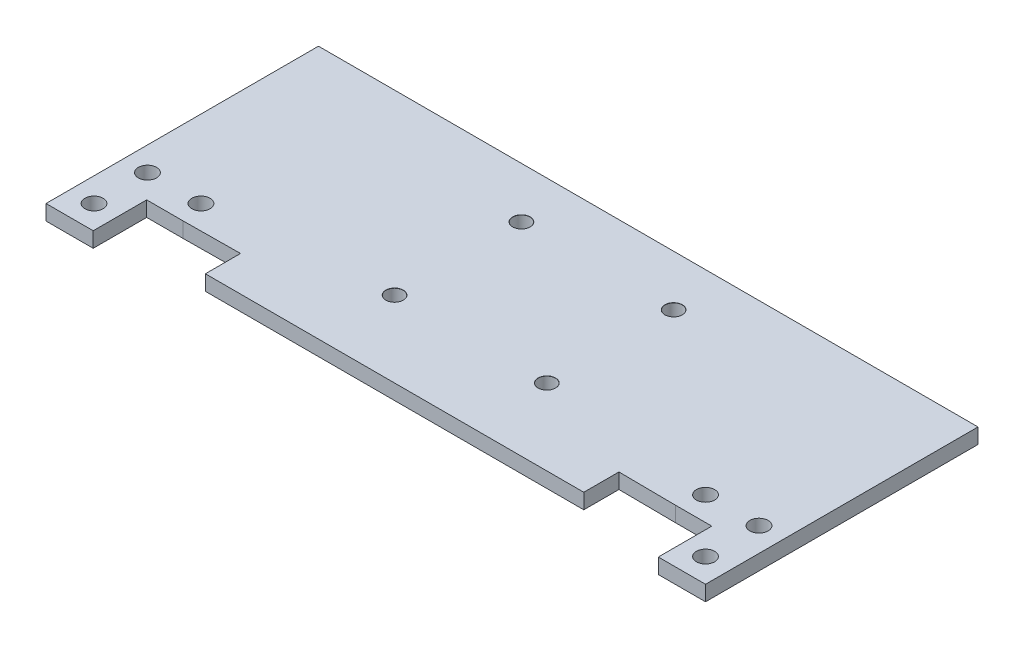
from build123d import *

# Parameters (mm, degrees)
SKETCH1_W                      = 50
SKETCH1_H                      = 3
BOSS_EXTRUDE1_DEPTH            = 130
M3_CLEARANCE_HOLE2_D           = 3.4
M3_CLEARANCE_HOLE2_CSINK_D     = 3.45
M3_CLEARANCE_HOLE2_CSINK_ANGLE = 90
SKETCH7_W                      = 9.304410209
SKETCH7_H                      = 3.710121499
BOSS_EXTRUDE2_DEPTH            = 3
CUT_EXTRUDE1_DEPTH             = 140.316187143
M3_CLEARANCE_HOLE3_D           = 3.6


with BuildPart() as part:
    # Sketch1 → Boss-Extrude1 (new body)
    with BuildSketch(Plane(origin=(0, 0, 0), x_dir=(0, 0, -1), z_dir=(1, 0, 0))):
        with Locations((25, 1.5)):
            Rectangle(SKETCH1_W, SKETCH1_H)
    extrude(amount=BOSS_EXTRUDE1_DEPTH)

    # M3 Clearance Hole2 (through all)
    with Locations(Plane(origin=(0, 3, 0), x_dir=(1, 0, 0), z_dir=(0, 1, 0))):
        with Locations((80, 15), (50, 40), (80, 40), (50, 15)):
            CounterSinkHole(M3_CLEARANCE_HOLE2_D / 2, M3_CLEARANCE_HOLE2_CSINK_D / 2, counter_sink_angle=M3_CLEARANCE_HOLE2_CSINK_ANGLE)

    # Sketch7 → Boss-Extrude2 (add)
    with BuildSketch(Plane.XZ):
        with Locations((125.347794896, 1.85506075)):
            Rectangle(SKETCH7_W, SKETCH7_H)
        with Locations((4.652205105, 1.85506075)):
            Rectangle(SKETCH7_W, SKETCH7_H)
    extrude(amount=-BOSS_EXTRUDE2_DEPTH)

    # Sketch9 → Cut-Extrude1 (cut, through all)
    with BuildSketch(Plane(origin=(0, 3, 0), x_dir=(1, 0, 0), z_dir=(0, 1, 0))):
        Polygon((120.495589791, 0), (120.495589791, 6.62967858), (113.495589791, 6.62967858), (102.495589791, 6.727622706), (102.495589791, 0), align=None)
        Polygon((120.495589791, -8.059319951), (120.495589791, 0), (102.495589791, 0), (102.495589791, -2.720319112), align=None)
        Polygon((120.695589791, 0), (120.495589791, 0), (120.495589791, -8.059319951), (102.495589791, -2.720319112), (102.495589791, 0), (102.295589791, 0), (102.295589791, -2.869609265), (120.695589791, -8.327254568), (120.695589791, -3.710121499), align=None)
        Polygon((113.495589791, 6.62967858), (120.495589791, 6.62967858), (120.495589791, 0), (120.695589791, 0), (120.695589791, 6.82967858), (113.496480192, 6.82967858), (102.295589791, 6.929411436), (102.295589791, 0), (102.495589791, 0), (102.495589791, 6.727622706), align=None)
        Polygon((9.304410209, 0), (27.704410209, 0), (27.704410209, 6.929411436), (16.503519826, 6.82967858), (9.304410209, 6.82967858), align=None)
        Polygon((27.704410209, -2.869609265), (27.704410209, 0), (9.304410209, 0), (9.304410209, -3.710121499), (9.304410209, -8.327254568), align=None)
    extrude(amount=-CUT_EXTRUDE1_DEPTH, mode=Mode.SUBTRACT)

    # M3 Clearance Hole3 (through all)
    with Locations(Plane(origin=(0, 3, 0), x_dir=(1, 0, 0), z_dir=(0, 1, 0))):
        with Locations((125.269900039, 1.019978462), (125.269900039, 11.559778541), (114.730099961, 11.559778541)):
            m3_clearance_hole3 = Hole(M3_CLEARANCE_HOLE3_D / 2)

    # Mirror1: M3 Clearance Hole3 across plane
    add(m3_clearance_hole3.mirror(Plane(origin=(65, 0, 0), x_dir=(0, 0, 1), z_dir=(1, 0, 0))), mode=Mode.SUBTRACT)


solid = part.part
